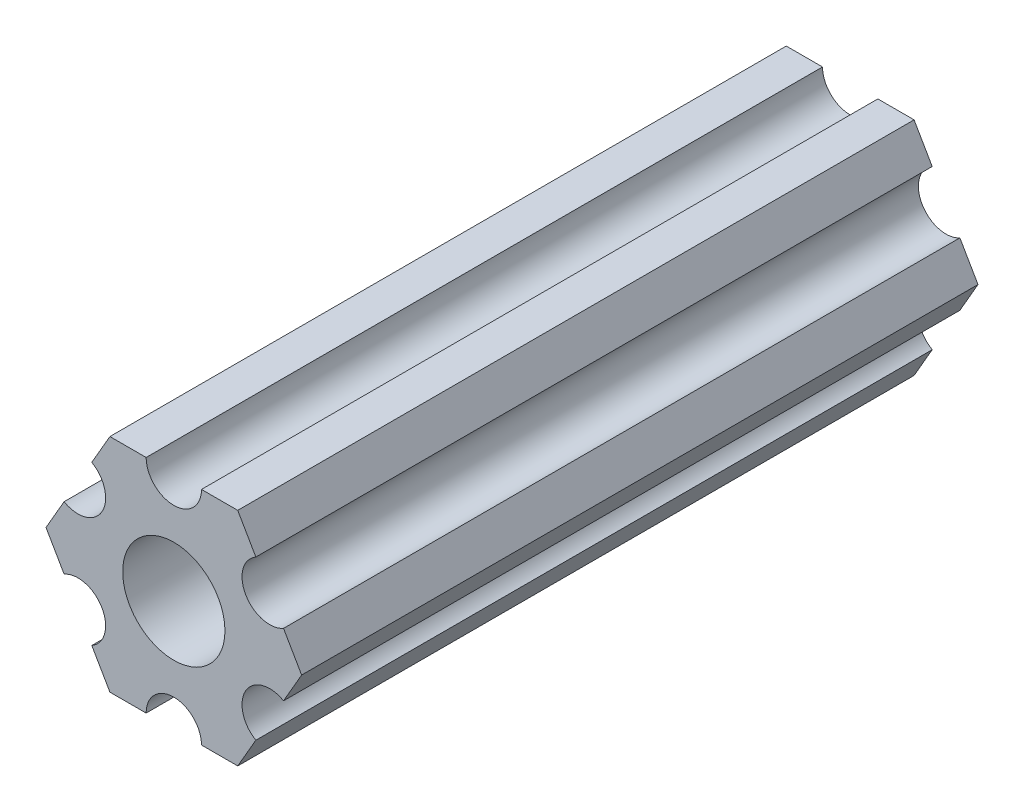
from build123d import *

# Parameters (mm, degrees)
SALIENTE_EXTRUIR1_DEPTH = 38.8


with BuildPart() as part:
    # Croquis1 → Saliente-Extruir1 (new body)
    with BuildSketch(Plane.XY):
        with BuildLine():
            Line((620.448376311, 354.810426019), (619.409039206, 356.610610691))
            Line((619.409039206, 356.610610691), (617.330364997, 356.610610691))
            ThreePointArc((617.330364997, 356.610610691), (616.536614955, 355.235795338), (614.949114914, 355.23579541))
            ThreePointArc((614.949114914, 355.23579541), (614.368049644, 355.816860732), (614.155364997, 356.610610691))
            Line((614.155364997, 356.610610691), (612.076690788, 356.610610691))
            Line((612.076690788, 356.610610691), (611.037353683, 354.810426019))
            ThreePointArc((611.037353683, 354.810426019), (611.618419011, 352.641860691), (609.449853683, 352.060795362))
            Line((609.449853683, 352.060795362), (608.410516578, 350.260610691))
            Line((608.410516578, 350.260610691), (609.449853683, 348.460426019))
            ThreePointArc((609.449853683, 348.460426019), (611.618419011, 347.879360691), (611.037353683, 345.710795362))
            Line((611.037353683, 345.710795362), (612.076690788, 343.910610691))
            Line((612.076690788, 343.910610691), (614.155364997, 343.910610691))
            ThreePointArc((614.155364997, 343.910610691), (615.742864997, 345.498110691), (617.330364997, 343.910610691))
            Line((617.330364997, 343.910610691), (619.409039206, 343.910610691))
            Line((619.409039206, 343.910610691), (620.448376311, 345.710795362))
            ThreePointArc((620.448376311, 345.710795362), (619.867310982, 347.879360691), (622.035876311, 348.460426019))
            Line((622.035876311, 348.460426019), (623.075213416, 350.260610691))
            Line((623.075213416, 350.260610691), (622.035876311, 352.060795362))
            ThreePointArc((622.035876311, 352.060795362), (621.242126263, 351.848110691), (620.448376228, 352.06079541))
            ThreePointArc((620.448376228, 352.06079541), (619.654626311, 353.435610739), (620.448376311, 354.810426019))
        make_face()
        with BuildLine():
            ThreePointArc((614.276014843, 347.719952052), (618.283523635, 348.793760537), (617.209715151, 352.801269329))
            ThreePointArc((617.209715151, 352.801269329), (613.202206359, 351.727460845), (614.276014843, 347.719952052))
        make_face(mode=Mode.SUBTRACT)
    extrude(amount=-SALIENTE_EXTRUIR1_DEPTH)


solid = part.part
